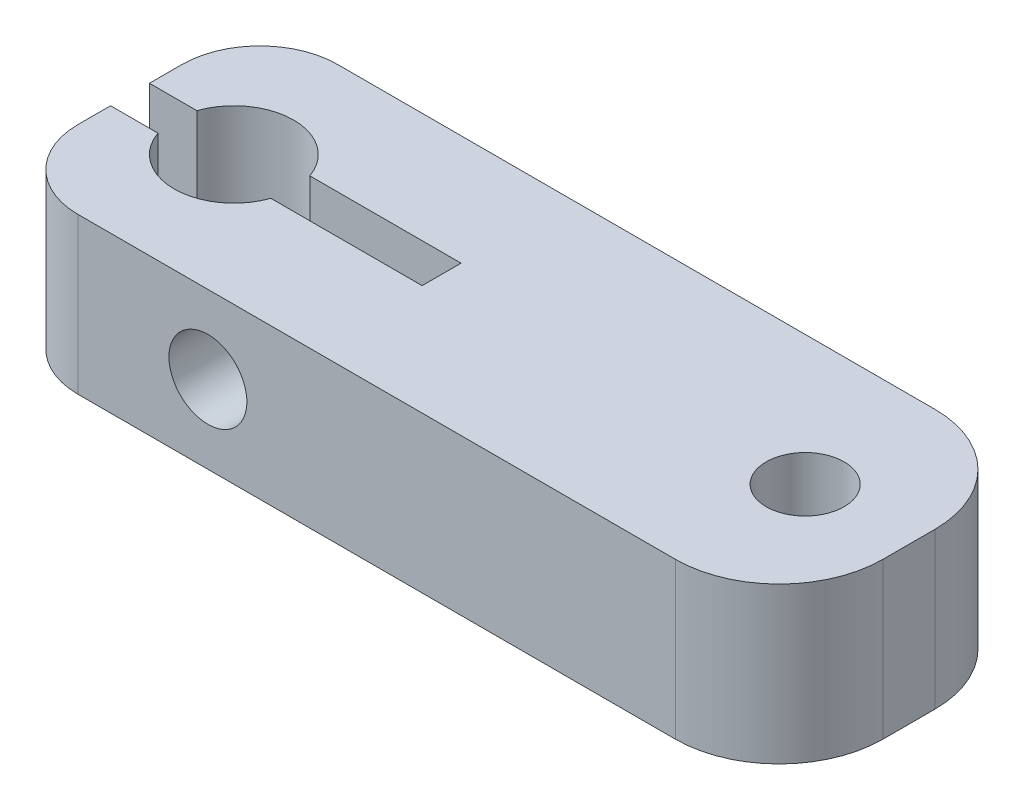
from build123d import *

# Parameters (mm, degrees)
SKETCH1_W           = 30
SKETCH1_H           = 10
SKETCH1_R           = 2.3
SKETCH1_R_2         = 1.5
BOSS_EXTRUDE1_DEPTH = 6
FILLET1_R           = 4
FILLET2_R           = 3
CUT_EXTRUDE1_REACH  = 23.433
SKETCH3_R           = 1.5
SKETCH4_R           = 1.75
CUT_EXTRUDE2_DEPTH  = 3
SKETCH7_R           = 2.5
CUT_EXTRUDE6_DEPTH  = 3
CUT_EXTRUDE7_START  = -6
SKETCH8_W           = 12
SKETCH8_H           = 1.5
CUT_EXTRUDE7_DEPTH  = 6


with BuildPart() as part:
    # Sketch1 → Boss-Extrude1 (new body)
    with BuildSketch(Plane(origin=(0, 0, 0), x_dir=(1, 0, 0), z_dir=(0, 1, 0))):
        with Locations((2.982829209, 12.310123294)):
            Rectangle(SKETCH1_W, SKETCH1_H)
        with Locations(Location((-8.017170791, 12.310123294, 0), (0, 0, 270))):
            Circle(SKETCH1_R, mode=Mode.SUBTRACT)
        with Locations(Location((13.982829209, 12.310123294, 0), (0, 0, 270))):
            Circle(SKETCH1_R_2, mode=Mode.SUBTRACT)
    extrude(amount=BOSS_EXTRUDE1_DEPTH)

    # Fillet1
    fillet1_edges = [part.edges().sort_by_distance(p)[0] for p in [
        (17.982829209, 3, -17.310123294),
        (17.982829209, 3, -7.310123294),
    ]]
    fillet(fillet1_edges, radius=FILLET1_R)

    # Fillet2
    fillet2_edges = [part.edges().sort_by_distance(p)[0] for p in [
        (-12.017170791, 3, -17.310123294),
        (-12.017170791, 3, -7.310123294),
    ]]
    fillet(fillet2_edges, radius=FILLET2_R)

    # Sketch3 → Cut-Extrude1 (cut, up to next)
    with BuildSketch(Plane(origin=(0, 0, -17.310123294), x_dir=(-1, 0, 0), z_dir=(0, 0, -1)), mode=Mode.PRIVATE) as cut_extrude1_sk1:
        with Locations((4.017170791, 3)):
            Circle(SKETCH3_R)
    cut_extrude1_tool1 = extrude(cut_extrude1_sk1.sketch, amount=-CUT_EXTRUDE1_REACH, mode=Mode.PRIVATE) & part.part
    add(cut_extrude1_tool1.solids().sort_by_distance((-4.017171, 3, -17.310123))[0], mode=Mode.SUBTRACT)

    # Sketch4 → Cut-Extrude2 (cut)
    with BuildSketch(Plane(origin=(0, 0, -17.310123294), x_dir=(-1, 0, 0), z_dir=(0, 0, -1))):
        with Locations((4.017170791, 3)):
            Circle(SKETCH4_R)
    extrude(amount=-CUT_EXTRUDE2_DEPTH, mode=Mode.SUBTRACT)

    # Sketch7 → Cut-Extrude6 (cut)
    with BuildSketch(Plane(origin=(0, 0, -17.310123294), x_dir=(-1, 0, 0), z_dir=(0, 0, -1))):
        with Locations((4.017170791, 3)):
            Circle(SKETCH7_R)
    extrude(amount=-CUT_EXTRUDE6_DEPTH, mode=Mode.SUBTRACT)

    # Sketch8 → Cut-Extrude7 (cut)
    with BuildSketch(Plane(origin=(0, 6, 0), x_dir=(1, 0, 0), z_dir=(0, 1, 0)).offset(CUT_EXTRUDE7_START)):
        with Locations((-6.017170791, 12.310123294)):
            Rectangle(SKETCH8_W, SKETCH8_H)
    extrude(amount=CUT_EXTRUDE7_DEPTH, mode=Mode.SUBTRACT)


solid = part.part
